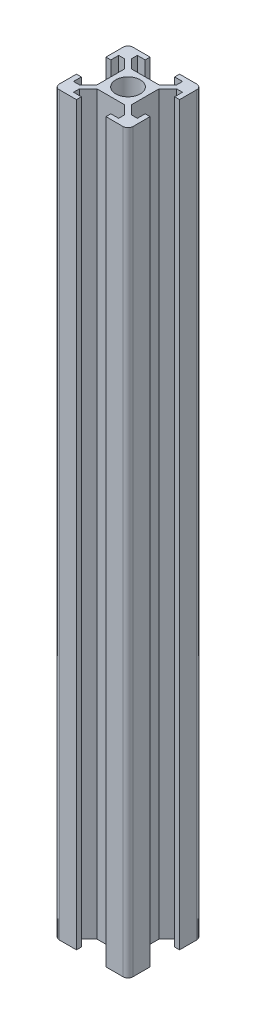
from build123d import *

# Parameters (mm, degrees)
BOSS_EXTRUDE1_DEPTH = 150


with BuildPart() as part:
    # Sketch1 → Boss-Extrude1 (new body)
    with BuildSketch(Plane(origin=(0, 0, 0), x_dir=(1, 0, 0), z_dir=(0, 1, 0))):
        with BuildLine():
            Line((-7.5, -3), (-7.5, -6.5))
            ThreePointArc((-7.5, -6.5), (-7.207106781, -7.207106781), (-6.5, -7.5))
            Line((-6.5, -7.5), (-3, -7.5))
            Line((-3, -7.5), (-3, -6.5))
            Line((-3, -6.5), (-4.6, -6.5))
            Line((-4.6, -6.5), (-4.6, -5.307106781))
            Line((-4.6, -5.307106781), (-2.8, -3.507106781))
            Line((-2.8, -3.507106781), (0, -3.507106781))
            Line((0, -3.507106781), (2.8, -3.507106781))
            Line((2.8, -3.507106781), (4.6, -5.307106781))
            Line((4.6, -5.307106781), (4.6, -6.5))
            Line((4.6, -6.5), (3, -6.5))
            Line((3, -6.5), (3, -7.5))
            Line((3, -7.5), (6.5, -7.5))
            ThreePointArc((6.5, -7.5), (7.207106781, -7.207106781), (7.5, -6.5))
            Line((7.5, -6.5), (7.5, -3))
            Line((7.5, -3), (6.5, -3))
            Line((6.5, -3), (6.5, -4.6))
            Line((6.5, -4.6), (5.307106781, -4.6))
            Line((5.307106781, -4.6), (3.507106781, -2.8))
            Line((3.507106781, -2.8), (3.507106781, 0))
            Line((3.507106781, 0), (3.507106781, 2.8))
            Line((3.507106781, 2.8), (5.307106781, 4.6))
            Line((5.307106781, 4.6), (6.5, 4.6))
            Line((6.5, 4.6), (6.5, 3))
            Line((6.5, 3), (7.5, 3))
            Line((7.5, 3), (7.5, 6.5))
            ThreePointArc((7.5, 6.5), (7.207106781, 7.207106781), (6.5, 7.5))
            Line((6.5, 7.5), (3, 7.5))
            Line((3, 7.5), (3, 6.5))
            Line((3, 6.5), (4.6, 6.5))
            Line((4.6, 6.5), (4.6, 5.307106781))
            Line((4.6, 5.307106781), (2.8, 3.507106781))
            Line((2.8, 3.507106781), (0, 3.507106781))
            Line((0, 3.507106781), (-2.8, 3.507106781))
            Line((-2.8, 3.507106781), (-4.6, 5.307106781))
            Line((-4.6, 5.307106781), (-4.6, 6.5))
            Line((-4.6, 6.5), (-3, 6.5))
            Line((-3, 6.5), (-3, 7.5))
            Line((-3, 7.5), (-6.5, 7.5))
            ThreePointArc((-6.5, 7.5), (-7.207106781, 7.207106781), (-7.5, 6.5))
            Line((-7.5, 6.5), (-7.5, 3))
            Line((-7.5, 3), (-6.5, 3))
            Line((-6.5, 3), (-6.5, 4.6))
            Line((-6.5, 4.6), (-5.307106781, 4.6))
            Line((-5.307106781, 4.6), (-3.507106781, 2.8))
            Line((-3.507106781, 2.8), (-3.507106781, 0))
            Line((-3.507106781, 0), (-3.507106781, -2.8))
            Line((-3.507106781, -2.8), (-5.307106781, -4.6))
            Line((-5.307106781, -4.6), (-6.5, -4.6))
            Line((-6.5, -4.6), (-6.5, -3))
            Line((-6.5, -3), (-7.5, -3))
        make_face()
        with BuildLine():
            ThreePointArc((-2.5, 0), (-1.767766953, -1.767766953), (0, -2.5))
            ThreePointArc((0, -2.5), (1.767766953, -1.767766953), (2.5, 0))
            ThreePointArc((2.5, 0), (1.767766953, 1.767766953), (0, 2.5))
            ThreePointArc((0, 2.5), (-1.767766953, 1.767766953), (-2.5, 0))
        make_face(mode=Mode.SUBTRACT)
    extrude(amount=BOSS_EXTRUDE1_DEPTH)


solid = part.part
